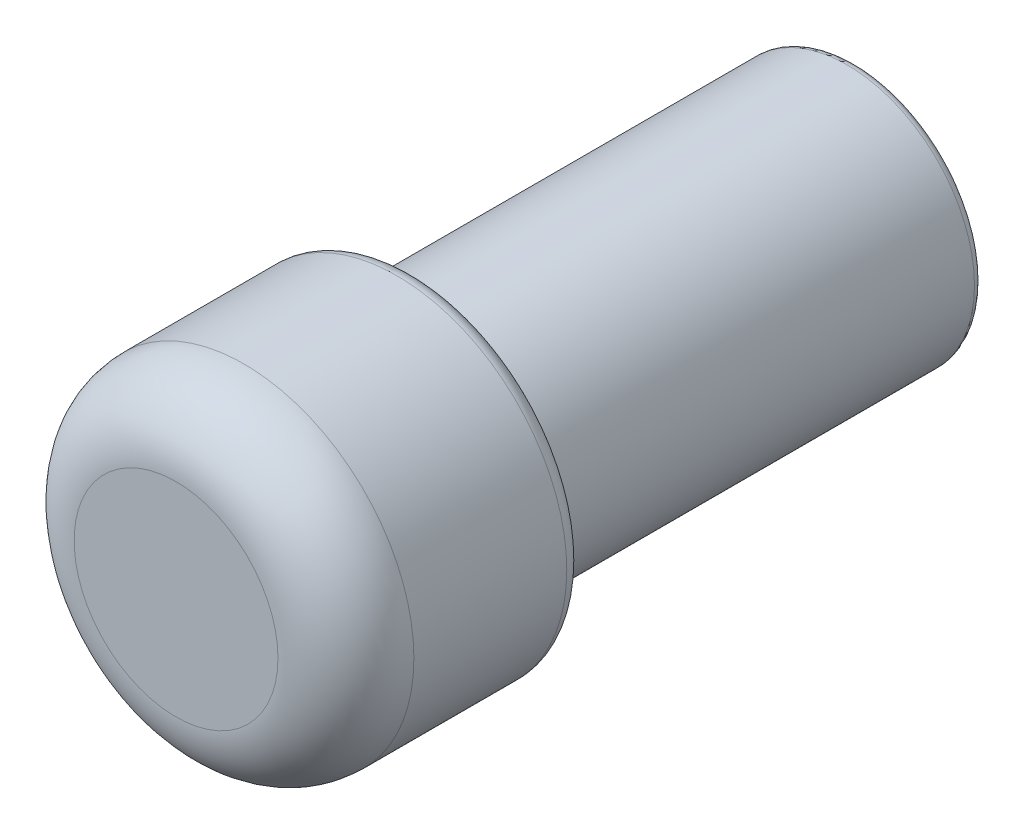
from build123d import *

# Parameters (mm, degrees)
SKETCH1_R           = 3.75
BOSS_EXTRUDE1_DEPTH = 13
SKETCH2_R           = 5
BOSS_EXTRUDE2_DEPTH = 7
SKETCH3_R           = 2.85
CUT_EXTRUDE1_DEPTH  = 15
FILLET1_R           = 0.5
FILLET2_R           = 0.25
FILLET3_R           = 2


with BuildPart() as part:
    # Sketch1 → Boss-Extrude1 (new body)
    with BuildSketch(Plane.XY):
        with Locations(Location((0, 0, 0), (0, 0, 180))):
            Circle(SKETCH1_R)
    extrude(amount=BOSS_EXTRUDE1_DEPTH)

    # Sketch2 → Boss-Extrude2 (add)
    with BuildSketch(Plane.XY.offset(13)):
        Circle(SKETCH2_R)
    extrude(amount=BOSS_EXTRUDE2_DEPTH)

    # Sketch3 → Cut-Extrude1 (cut)
    with BuildSketch(Plane(origin=(0, 0, 0), x_dir=(-1, 0, 0), z_dir=(0, 0, -1))):
        Circle(SKETCH3_R)
    extrude(amount=-CUT_EXTRUDE1_DEPTH, mode=Mode.SUBTRACT)

    # Fillet1
    fillet1_edges = [part.edges().sort_by_distance(p)[0] for p in [
        (3.75, 0, 13),
        (-5, 0, 13),
    ]]
    fillet(fillet1_edges, radius=FILLET1_R)

    # Fillet2
    fillet2_edges = [part.edges().sort_by_distance(p)[0] for p in [
        (2.85, 0, 0),
        (3.75, 0, 0),
    ]]
    fillet(fillet2_edges, radius=FILLET2_R)

    # Fillet3
    fillet3_edges = [part.edges().sort_by_distance(p)[0] for p in [
        (-5, 0, 20),
    ]]
    fillet(fillet3_edges, radius=FILLET3_R)


solid = part.part
